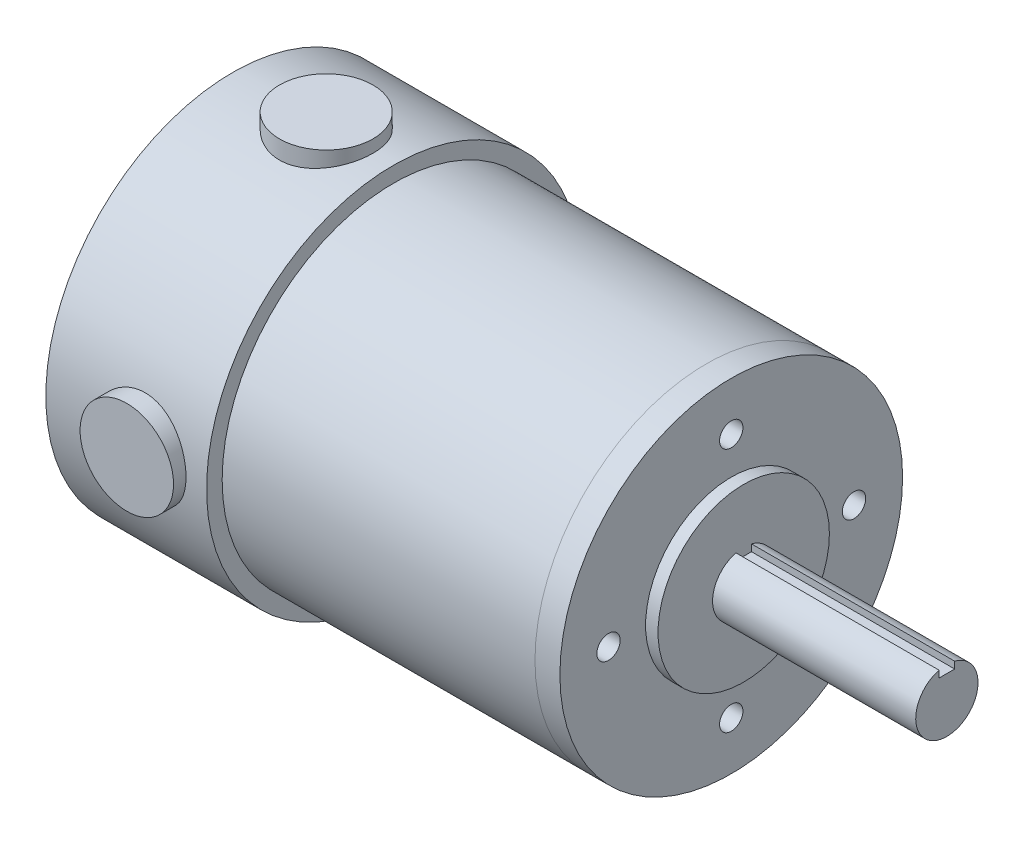
from build123d import *

# Parameters (mm, degrees)
SKETCH1_R          = 38.1
EXTRUDE1_DEPTH     = 32.766
SKETCH5_R          = 6.35
EXTRUDE5_DEPTH     = 18.288
SKETCH2_R          = 34.925
EXTRUDE6_DEPTH     = 63.754
SKETCH6_R          = 34.925
EXTRUDE7_DEPTH     = 5.08
SKETCH7_R          = 17.4625
EXTRUDE8_DEPTH     = 2.54
EXTRUDE9_START     = 43.942
SKETCH8_R          = 6.35
EXTRUDE9_DEPTH     = 43.942
SKETCH9_W          = 3.175
SKETCH9_H          = 3.175
CUT_EXTRUDE1_DEPTH = 41.402
SKETCH10_W         = 3.175
SKETCH10_H         = 3.175
CUT_EXTRUDE2_DEPTH = 18.288
SKETCH11_R         = 9.525
EXTRUDE10_DEPTH    = 40.64
SKETCH12_R         = 9.525
EXTRUDE11_DEPTH    = 40.64
SKETCH13_R         = 2.38125
CUT_EXTRUDE3_DEPTH = 9.525


with BuildPart() as part:
    # Sketch1 → Extrude1 (new body)
    with BuildSketch(Plane(origin=(0, 0, 0), x_dir=(0, 0, -1), z_dir=(1, 0, 0))):
        Circle(SKETCH1_R)
    extrude(amount=EXTRUDE1_DEPTH)

    # Sketch5 → Extrude5 (add)
    with BuildSketch(Plane.ZY):
        with Locations(Location((0, 0, 0), (0, 0, 180))):
            Circle(SKETCH5_R)
    extrude(amount=EXTRUDE5_DEPTH)

    # Sketch2 → Extrude6 (add)
    with BuildSketch(Plane(origin=(32.766, 0, 0), x_dir=(0, 0, -1), z_dir=(1, 0, 0))):
        Circle(SKETCH2_R)
    extrude(amount=EXTRUDE6_DEPTH)

    # Sketch10 → Cut-Extrude2 (cut)
    with BuildSketch(Plane.ZY.offset(18.288)):
        with Locations((0, 6.35)):
            Rectangle(SKETCH10_W, SKETCH10_H)
    extrude(amount=-CUT_EXTRUDE2_DEPTH, mode=Mode.SUBTRACT)

    # Sketch11 → Extrude10 (add, symmetric)
    with BuildSketch(Plane(origin=(0, 0, 0), x_dir=(1, 0, 0), z_dir=(0, 1, 0))):
        with Locations(Location((19.05, 0, 0), (0, 0, 90))):
            Circle(SKETCH11_R)
    extrude(amount=EXTRUDE10_DEPTH, both=True)

    # Sketch12 → Extrude11 (add, symmetric)
    with BuildSketch(Plane.XY):
        with Locations((19.05, 0)):
            Circle(SKETCH12_R)
    extrude(amount=EXTRUDE11_DEPTH, both=True)


with BuildPart() as body_2:
    # Sketch6 → Extrude7 (new body)
    with BuildSketch(Plane(origin=(96.52, 0, 0), x_dir=(0, 0, -1), z_dir=(1, 0, 0))):
        Circle(SKETCH6_R)
    extrude(amount=EXTRUDE7_DEPTH)

    # Sketch7 → Extrude8 (add)
    with BuildSketch(Plane(origin=(101.6, 0, 0), x_dir=(0, 0, -1), z_dir=(1, 0, 0))):
        Circle(SKETCH7_R)
    extrude(amount=EXTRUDE8_DEPTH)

    # Sketch8 → Extrude9 (add)
    with BuildSketch(Plane(origin=(101.6, 0, 0), x_dir=(0, 0, -1), z_dir=(1, 0, 0)).offset(EXTRUDE9_START)):
        with Locations(Location((0, 0, 0), (0, 0, 180))):
            Circle(SKETCH8_R)
    extrude(amount=-EXTRUDE9_DEPTH)

    # Sketch9 → Cut-Extrude1 (cut)
    with BuildSketch(Plane(origin=(145.542, 0, 0), x_dir=(0, 0, -1), z_dir=(1, 0, 0))):
        with Locations((0, 6.35)):
            Rectangle(SKETCH9_W, SKETCH9_H)
    extrude(amount=-CUT_EXTRUDE1_DEPTH, mode=Mode.SUBTRACT)


with BuildPart() as cut_extrude3_tool:
    # Sketch13 → Cut-Extrude3 (new body)
    with BuildSketch(Plane(origin=(101.6, 0, 0), x_dir=(0, 0, -1), z_dir=(1, 0, 0))):
        with Locations((25.019, 0)):
            Circle(SKETCH13_R)
        with Locations((0, 25.019)):
            Circle(SKETCH13_R)
        with Locations((-25.019, 0)):
            Circle(SKETCH13_R)
        with Locations((0, -25.019)):
            Circle(SKETCH13_R)
    extrude(amount=-CUT_EXTRUDE3_DEPTH)


with BuildPart() as part_1:
    add(part.part)

    # Cut-Extrude3: cut by cut_extrude3_tool
    add(cut_extrude3_tool.part, mode=Mode.SUBTRACT)


with BuildPart() as body_2_1:
    add(body_2.part)

    # Cut-Extrude3: cut by cut_extrude3_tool
    add(cut_extrude3_tool.part, mode=Mode.SUBTRACT)


solid = Compound([part_1.part, body_2_1.part])
